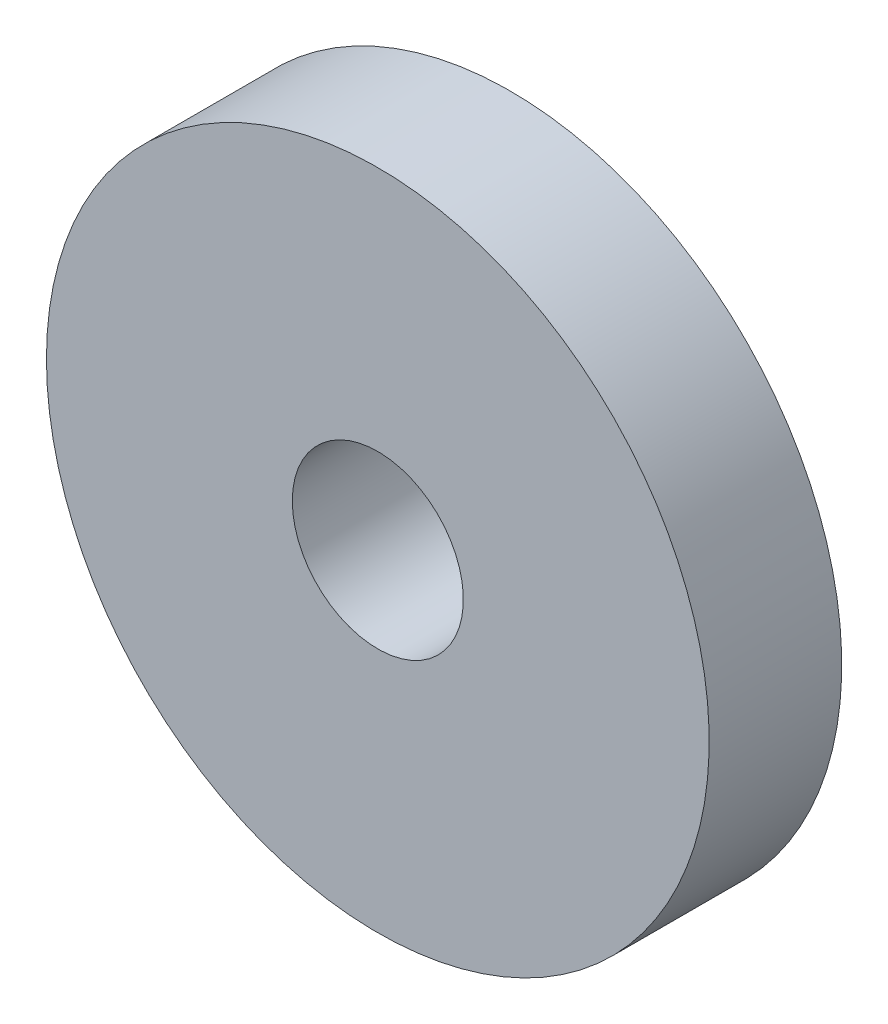
from build123d import *

# Parameters (mm, degrees)
SKETCH1_R           = 15.5
SKETCH1_R_2         = 4
BOSS_EXTRUDE1_DEPTH = 6.2


with BuildPart() as part:
    # Sketch1 → Boss-Extrude1 (new body)
    with BuildSketch(Plane.XY):
        with Locations(Location((0, 0, 0), (0, 0, 180))):
            Circle(SKETCH1_R)
        with Locations(Location((0, 0, 0), (0, 0, 180))):
            Circle(SKETCH1_R_2, mode=Mode.SUBTRACT)
    extrude(amount=BOSS_EXTRUDE1_DEPTH)


solid = part.part
